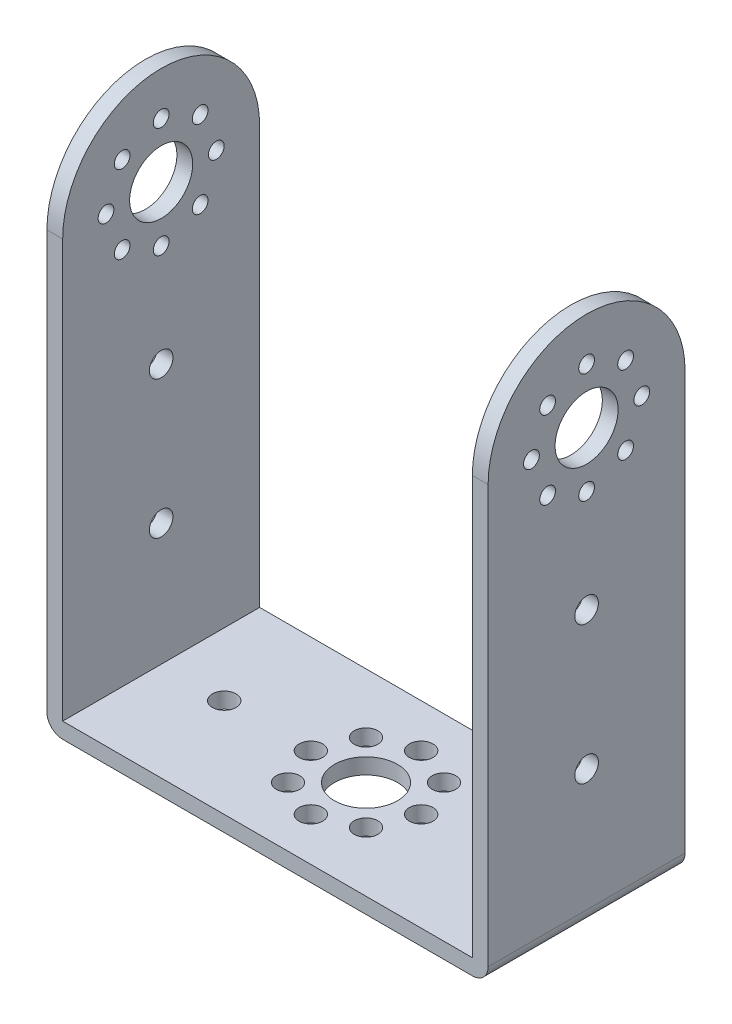
from build123d import *

# Parameters (mm, degrees)
SKETCH_1_W          = 56
SKETCH_1_H          = 25
EXTRUDE_1_DEPTH     = 2
EXTRUDE_2_DEPTH     = 2
SKETCH_3_R          = 4
SKETCH_3_R_2        = 1
CUT_EXTRUDE_1_DEPTH = 105
SKETCH_4_R          = 1.5
CUT_EXTRUDE_2_DEPTH = 105
SKETCH_5_R          = 1.5
CUT_EXTRUDE_3_DEPTH = 105
SKETCH_6_R          = 1.5
SKETCH_6_R_2        = 4
CUT_EXTRUDE_5_DEPTH = 105
CUT_EXTRUDE_6_DEPTH = 84.41891632


with BuildPart() as part:
    # 草图1 → 凸台-拉伸1 (new body)
    with BuildSketch(Plane(origin=(0, 0, 0), x_dir=(1, 0, 0), z_dir=(0, 1, 0))):
        with Locations((14.16, -0.793333333)):
            Rectangle(SKETCH_1_W, SKETCH_1_H)
    extrude(amount=EXTRUDE_1_DEPTH)

    # 草图2 → 凸台-拉伸2 (add)
    with BuildSketch(Plane(origin=(42.16, 0, 0), x_dir=(0, 0, -1), z_dir=(1, 0, 0))):
        with BuildLine():
            Line((-13.293333333, 2), (-13.293333333, 55))
            ThreePointArc((-13.293333333, 55), (-0.793333333, 67.5), (11.706666667, 55))
            Line((11.706666667, 55), (11.706666667, 2))
            Line((11.706666667, 2), (-13.293333333, 2))
        make_face()
    extrude_2 = extrude(amount=-EXTRUDE_2_DEPTH)

    # 镜向1: 凸台-拉伸2 across plane
    add(extrude_2.mirror(Plane.ZY.offset(-14.16)))

    # 草图3 → 切除-拉伸1 (cut)
    with BuildSketch(Plane(origin=(42.16, 0, 0), x_dir=(0, 0, -1), z_dir=(1, 0, 0))):
        with Locations((-0.793333333, 55)):
            Circle(SKETCH_3_R)
        with Locations((-0.793333333, 62)):
            Circle(SKETCH_3_R_2)
        with Locations((4.156414135, 59.949747468)):
            Circle(SKETCH_3_R_2)
        with Locations((6.206666667, 55)):
            Circle(SKETCH_3_R_2)
        with Locations((4.156414135, 50.050252532)):
            Circle(SKETCH_3_R_2)
        with Locations((-0.793333333, 48)):
            Circle(SKETCH_3_R_2)
        with Locations((-5.743080802, 50.050252532)):
            Circle(SKETCH_3_R_2)
        with Locations((-7.793333333, 55)):
            Circle(SKETCH_3_R_2)
        with Locations((-5.743080802, 59.949747468)):
            Circle(SKETCH_3_R_2)
    extrude(amount=-CUT_EXTRUDE_1_DEPTH, mode=Mode.SUBTRACT)

    # 草图4 → 切除-拉伸2 (cut)
    with BuildSketch(Plane(origin=(42.16, 0, 0), x_dir=(0, 0, -1), z_dir=(1, 0, 0))):
        with Locations((-0.793333333, 17.5)):
            Circle(SKETCH_4_R)
        with Locations((-0.793333333, 35)):
            Circle(SKETCH_4_R)
    extrude(amount=-CUT_EXTRUDE_2_DEPTH, mode=Mode.SUBTRACT)

    # 草图5 → 切除-拉伸3 (cut)
    with BuildSketch(Plane(origin=(0, 2, 0), x_dir=(1, 0, 0), z_dir=(0, 1, 0))):
        with Locations(Location((32.16, -0.793333333, 0), (0, 0, 270))):
            Circle(SKETCH_5_R)
        with BuildLine():
            ThreePointArc((-3.84, 0.706666667), (-5.34, -0.793333333), (-3.84, -2.293333333))
            Line((-3.84, -2.293333333), (-3.84, 0.706666667))
        make_face()
        with BuildLine():
            Line((-3.84, 0.706666667), (-3.84, -2.293333333))
            ThreePointArc((-3.84, -2.293333333), (-2.779339828, -1.853993505), (-2.34, -0.793333333))
            ThreePointArc((-2.34, -0.793333333), (-2.779339828, 0.267326838), (-3.84, 0.706666667))
        make_face()
    extrude(amount=-CUT_EXTRUDE_3_DEPTH, mode=Mode.SUBTRACT)

    # 草图6 → 切除-拉伸5 (cut)
    with BuildSketch(Plane(origin=(0, 2, 0), x_dir=(1, 0, 0), z_dir=(0, 1, 0))):
        with Locations(Location((14.16, -7.793333333, 0), (0, 0, 270))):
            Circle(SKETCH_6_R)
        with Locations(Location((9.210252532, -5.743080802, 0), (0, 0, 270))):
            Circle(SKETCH_6_R)
        with Locations(Location((7.16, -0.793333333, 0), (0, 0, 270))):
            Circle(SKETCH_6_R)
        with Locations(Location((9.210252532, 4.156414135, 0), (0, 0, 270))):
            Circle(SKETCH_6_R)
        with Locations(Location((14.16, 6.206666667, 0), (0, 0, 270))):
            Circle(SKETCH_6_R)
        with Locations(Location((19.109747468, 4.156414135, 0), (0, 0, 270))):
            Circle(SKETCH_6_R)
        with Locations(Location((21.16, -0.793333333, 0), (0, 0, 270))):
            Circle(SKETCH_6_R)
        with Locations(Location((19.109747468, -5.743080802, 0), (0, 0, 270))):
            Circle(SKETCH_6_R)
        with Locations(Location((14.16, -0.793333333, 0), (0, 0, 270))):
            Circle(SKETCH_6_R_2)
    extrude(amount=-CUT_EXTRUDE_5_DEPTH, mode=Mode.SUBTRACT)

    # 草图7 → 切除-拉伸6 (cut, through all)
    with BuildSketch(Plane.XY.offset(13.293333333)):
        with BuildLine():
            Line((-13.84, 0), (-11.84, 0))
            ThreePointArc((-11.84, 0), (-13.254213562, 0.585786438), (-13.84, 2))
            Line((-13.84, 2), (-13.84, 0))
        make_face()
        with BuildLine():
            ThreePointArc((42.16, 2), (41.574213562, 0.585786438), (40.16, 0))
            Line((40.16, 0), (42.16, 0))
            Line((42.16, 0), (42.16, 2))
        make_face()
    extrude(amount=-CUT_EXTRUDE_6_DEPTH, mode=Mode.SUBTRACT)


solid = part.part
